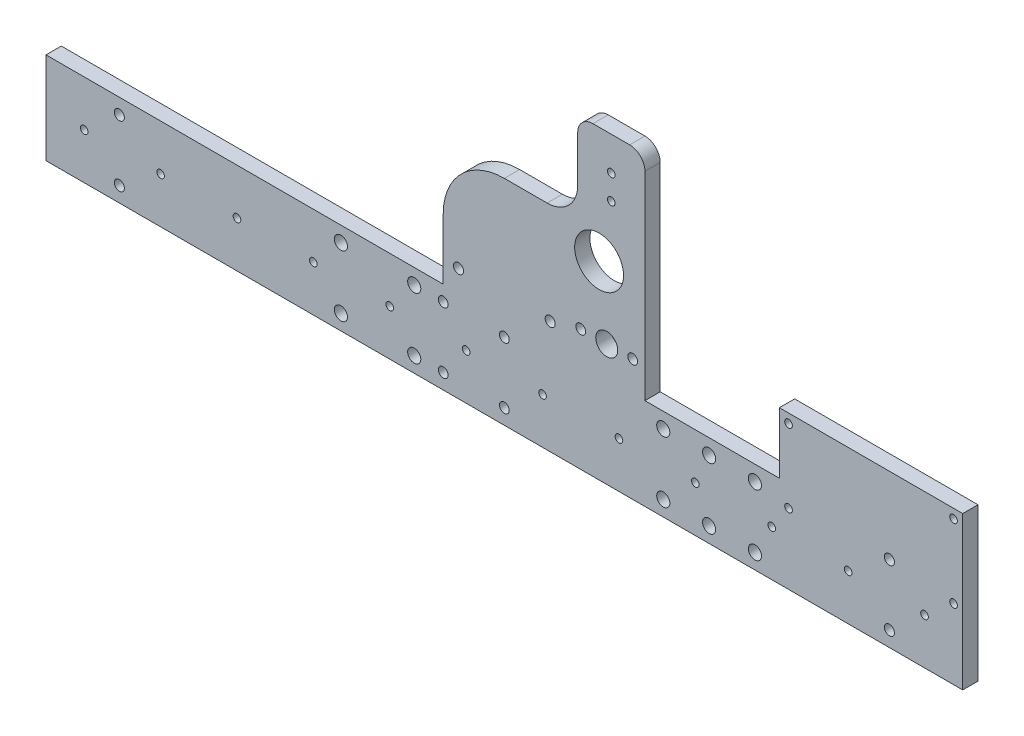
from build123d import *

# Parameters (mm, degrees)
SKETCH_1_W                 = 300
SKETCH_1_H                 = 30
EXTRUDE_1_DEPTH            = 5
HOLE_WIZARD_M3_1_D         = 3.2
M3X0_5_1_D                 = 2.5
HOLE_WIZARD_M4_2_D         = 4.3
M4X0_7_2_D                 = 3.3
PATTERN_LINEAR_1_COUNT     = 6
PATTERN_LINEAR_1_PITCH     = 25
PATTERN_LINEAR_1_COL_COUNT = 7
PATTERN_LINEAR_1_COL_PITCH = 25
EXTRUDE_3_DEPTH            = 5
SKETCH_13_R                = 3.6
CUT_EXTRUDE_2_DEPTH        = 160.843673631
M4X0_7_3_D                 = 3.3
HOLE_WIZARD_M4_1_D         = 4.3
SKETCH_26_W                = 22
SKETCH_26_H                = 5
EXTRUDE_4_DEPTH            = 30
M3X0_5_2_D                 = 2.5
HOLE_WIZARD_M3_2_D         = 3.2
FILLET_2_R                 = 5
SKETCH_36_R                = 8
CUT_EXTRUDE_3_DEPTH        = 173.481883107
PATTERN_LINEAR_3_COUNT     = 3
PATTERN_LINEAR_3_PITCH     = 15
SKETCH_40_W                = 60
SKETCH_40_H                = 5
EXTRUDE_6_DEPTH            = 20
M3X0_5_3_D                 = 2.5
FILLET_3_R                 = 10


with BuildPart() as part:
    # 草圖1 → 填料-伸長1 (new body)
    with BuildSketch(Plane.XY):
        Rectangle(SKETCH_1_W, SKETCH_1_H)
    extrude(amount=EXTRUDE_1_DEPTH)

    # M3 餘隙孔1 (through all)
    with Locations(Plane.XY.offset(5)):
        with Locations((0, -10), (0, 10), (-20, -10), (-20, 10)):
            Hole(HOLE_WIZARD_M3_1_D / 2)

    # M3x0.5 螺紋孔1 (through all)
    with Locations(Plane.XY.offset(5)):
        with Locations((-12.5, 0)):
            m3x0_5_1 = Hole(M3X0_5_1_D / 2)

    # M4 餘隙孔2 (through all)
    with Locations(Plane.XY.offset(5)):
        with Locations((52, -10), (52, 10)):
            hole_wizard_m4_2 = Hole(HOLE_WIZARD_M4_2_D / 2)

    # M4x0.7 螺紋孔2 (through all)
    with Locations(Plane.XY.offset(5)):
        with Locations((-126, 10), (-126, -10)):
            m4x0_7_2 = Hole(M4X0_7_2_D / 2)

    # 直線複製排列1: M3x0.5 螺紋孔1 ×6
    with Locations(*[(-i * PATTERN_LINEAR_1_PITCH, 0, 0) for i in range(1, PATTERN_LINEAR_1_COUNT)]):
        add(m3x0_5_1, mode=Mode.SUBTRACT)

    # 直線複製排列1 col: M3x0.5 螺紋孔1 ×7
    with Locations(*[(i * PATTERN_LINEAR_1_COL_PITCH, 0, 0) for i in range(1, PATTERN_LINEAR_1_COL_COUNT)]):
        add(m3x0_5_1, mode=Mode.SUBTRACT)

    # 鏡射1: M4x0.7 螺紋孔2 across plane
    add(m4x0_7_2.mirror(Plane(origin=(0, 0, 0), x_dir=(0, 0, 1), z_dir=(1, 0, 0))), mode=Mode.SUBTRACT)

    # 草圖16 → 填料-伸長3 (add, through all)
    with BuildSketch(Plane.XY):
        with BuildLine():
            Line((-20, 15), (46, 15))
            Line((46, 15), (46, 55))
            Line((46, 55), (0, 55))
            ThreePointArc((0, 55), (-14.142135624, 49.142135624), (-20, 35))
            Line((-20, 35), (-20, 15))
        make_face()
    extrude(amount=EXTRUDE_3_DEPTH)

    # 草圖13 → 除料-伸長2 (cut, through all)
    with BuildSketch(Plane.XY):
        with Locations(Location((33.5, 24.8, 0), (0, 0, 180))):
            Circle(SKETCH_13_R)
    extrude(amount=CUT_EXTRUDE_2_DEPTH, mode=Mode.SUBTRACT)

    # M4x0.7 螺紋孔3 (through all)
    with Locations(Plane.XY.offset(5)):
        with Locations((15, 22), (-15, 22)):
            Hole(M4X0_7_3_D / 2)

    # M4 餘隙孔1 (through all)
    with Locations(Plane.XY.offset(5)):
        with Locations((-29.5, -10), (-29.5, 10), (-53.5, -10), (-53.5, 10)):
            Hole(HOLE_WIZARD_M4_1_D / 2)

    # 草圖26 → 填料-伸長4 (add)
    with BuildSketch(Plane(origin=(0, 55, 0), x_dir=(1, 0, 0), z_dir=(0, 1, 0))):
        with Locations((35, -2.5)):
            Rectangle(SKETCH_26_W, SKETCH_26_H)
    extrude(amount=EXTRUDE_4_DEPTH)

    # M3x0.5 螺紋孔2 (through all)
    with Locations(Plane.XY.offset(5)):
        with Locations((35, 74), (35, 66)):
            Hole(M3X0_5_2_D / 2)

    # M3 餘隙孔2 (through all)
    with Locations(Plane.XY.offset(5)):
        with Locations((25, 24.8), (42, 24.8)):
            Hole(HOLE_WIZARD_M3_2_D / 2)

    # 圓角2
    fillet_2_edges = [part.edges().sort_by_distance(p)[0] for p in [
        (46, 85, 2.5),
        (24, 85, 2.5),
    ]]
    fillet(fillet_2_edges, radius=FILLET_2_R)

    # 草圖36 → 除料-伸長3 (cut, through all)
    with BuildSketch(Plane.XY.offset(5)):
        with Locations((31, 47)):
            Circle(SKETCH_36_R)
    extrude(amount=-CUT_EXTRUDE_3_DEPTH, mode=Mode.SUBTRACT)

    # 直線複製排列3: M4 餘隙孔2 ×3
    with Locations(*[(i * PATTERN_LINEAR_3_PITCH, 0, 0) for i in range(1, PATTERN_LINEAR_3_COUNT)]):
        add(hole_wizard_m4_2, mode=Mode.SUBTRACT)

    # 草圖40 → 填料-伸長6 (add)
    with BuildSketch(Plane(origin=(0, 15, 0), x_dir=(1, 0, 0), z_dir=(0, 1, 0))):
        with Locations((120, -2.5)):
            Rectangle(SKETCH_40_W, SKETCH_40_H)
    extrude(amount=EXTRUDE_6_DEPTH)

    # M3x0.5 螺紋孔3 (through all)
    with Locations(Plane(origin=(0, 0, 0), x_dir=(-1, 0, 0), z_dir=(0, 0, -1))):
        with Locations((-147, 32), (-93, 8), (-147, 8), (-93, 32)):
            Hole(M3X0_5_3_D / 2)

    # 圓角3
    fillet_3_edges = [part.edges().sort_by_distance(p)[0] for p in [
        (24, 55, 2.5),
    ]]
    fillet(fillet_3_edges, radius=FILLET_3_R)


solid = part.part
